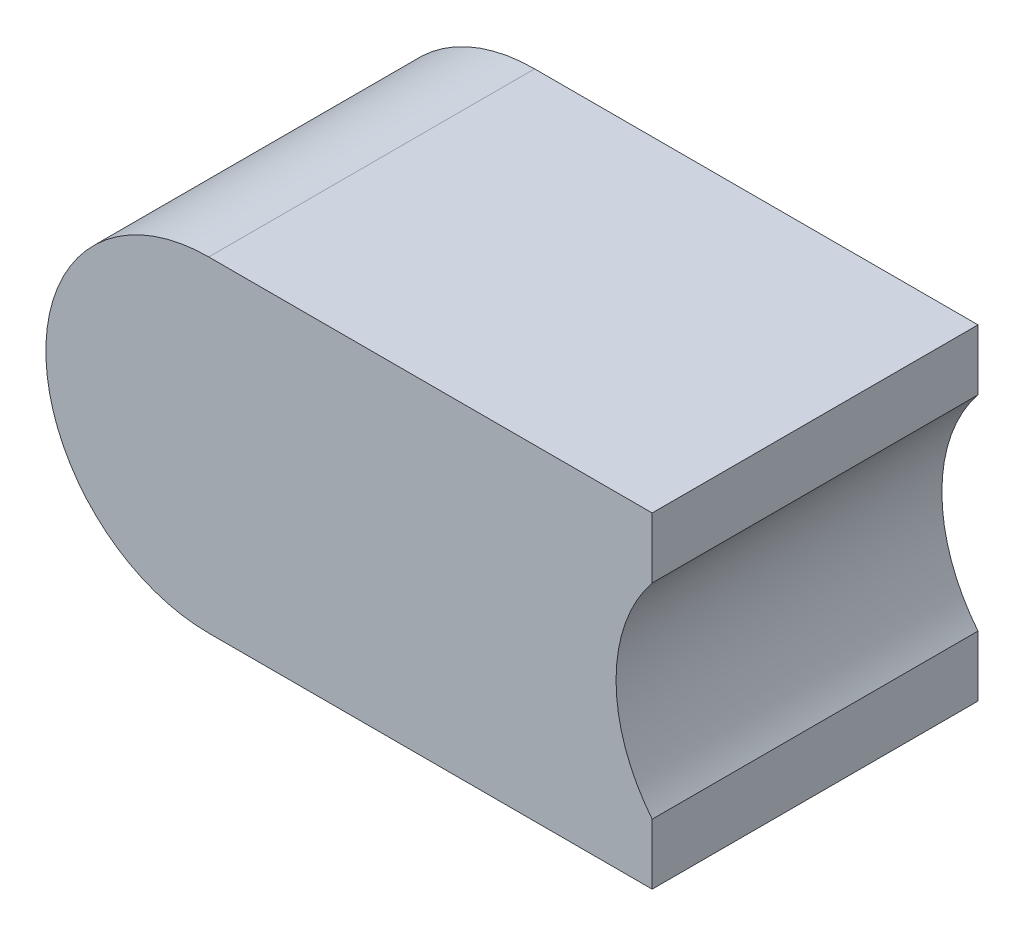
from build123d import *

# Parameters (mm, degrees)
BOSS_EXTRUDE1_DEPTH = 50.8


with BuildPart() as part:
    # Sketch1 → Boss-Extrude1 (new body)
    with BuildSketch(Plane.XY):
        with BuildLine():
            Line((0, 0), (69.130026135, 0))
            Line((69.130026135, 0), (69.130026135, 9.452958475))
            ThreePointArc((69.130026135, 9.452958475), (63.5, 25.4), (69.130026135, 41.347041525))
            Line((69.130026135, 41.347041525), (69.130026135, 50.8))
            Line((69.130026135, 50.8), (0, 50.8))
            ThreePointArc((0, 50.8), (-25.4, 25.4), (0, 0))
        make_face()
    extrude(amount=BOSS_EXTRUDE1_DEPTH)


solid = part.part
